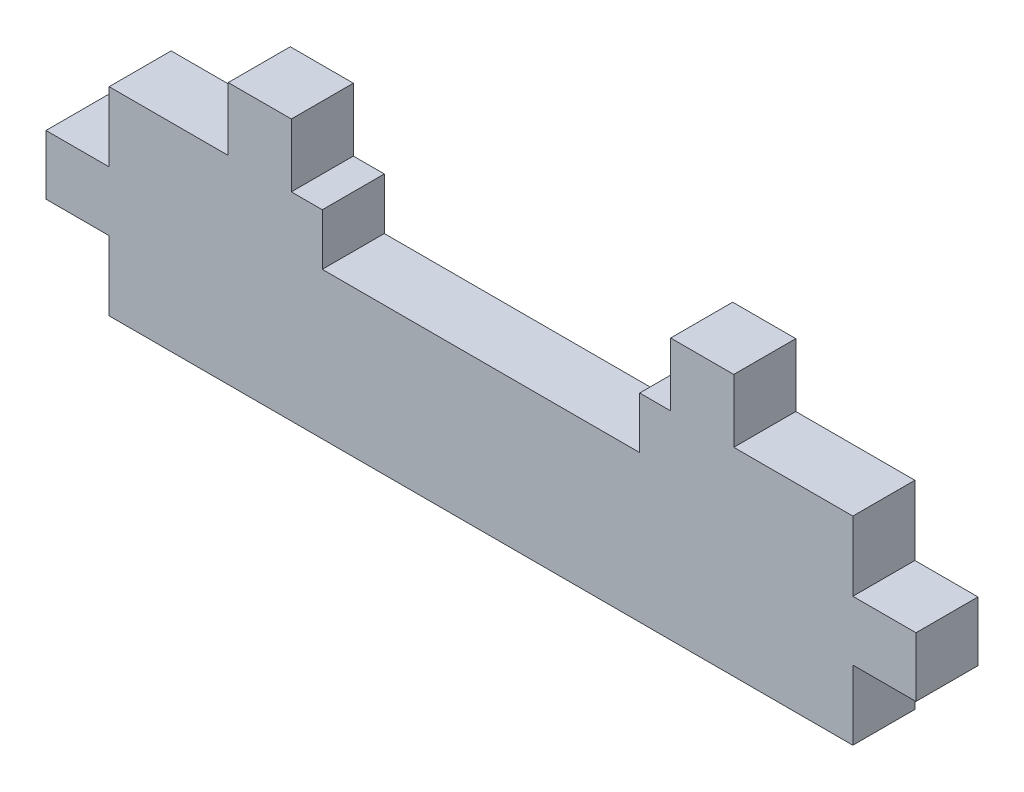
from build123d import *

# Parameters (mm, degrees)
BOSS_EXTRUDE1_DEPTH = 3.125


with BuildPart() as part:
    # Sketch2 → Boss-Extrude1 (new body)
    with BuildSketch(Plane.XY):
        Polygon((0, -6.59), (18.735, -6.59), (18.735, -3.09), (21.915, -3.09), (21.915, -0.09), (18.735, -0.09), (18.735, 3.41), (12.735, 3.41), (12.735, 6.59), (9.555, 6.59), (9.555, 3.41), (7.995, 3.41), (7.995, 0.81), (0.569270121, 0.81), (0, 0.81), align=None)
    boss_extrude1 = extrude(amount=BOSS_EXTRUDE1_DEPTH)

    # Mirror1: Boss-Extrude1 across plane
    add(boss_extrude1.mirror(Plane(origin=(0, -6.59, 3.125), x_dir=(0, 0, 1), z_dir=(1, 0, 0))))


solid = part.part
